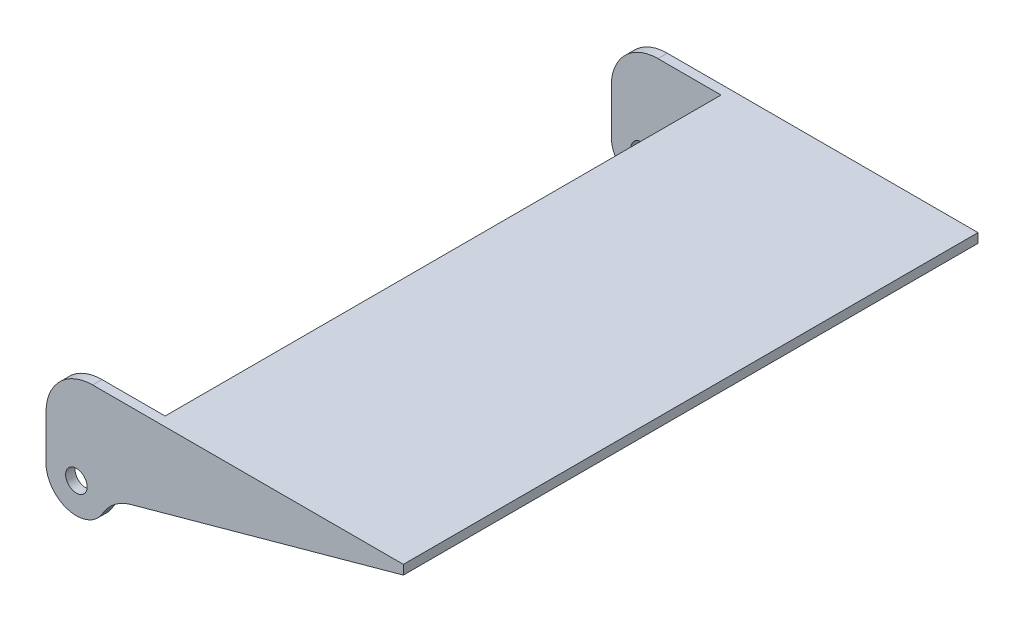
from build123d import *

# Parameters (mm, degrees)
SKETCH1_W               = 50
SKETCH1_H               = 123
BOSS_EXTRUDE1_DEPTH     = 2
BOSS_EXTRUDE2_DEPTH     = 123
CUT_EXTRUDE1_DEPTH      = 84.729178306
CUT_EXTRUDE1_DEPTH_BACK = 84.729178306
SKETCH3_W               = 119
SKETCH3_H               = 24.000498671
CUT_EXTRUDE2_DEPTH      = 85.324239069
CUT_EXTRUDE2_DEPTH_BACK = 85.324239069
SKETCH4_W               = 30.227049201
SKETCH4_H               = 119
CUT_EXTRUDE3_DEPTH      = 136.489207319
CUT_EXTRUDE3_DEPTH_BACK = 136.489207319
SKETCH5_R               = 2.3


with BuildPart() as part:
    # Sketch1 → Boss-Extrude1 (new body)
    with BuildSketch(Plane(origin=(0, 0, 0), x_dir=(1, 0, 0), z_dir=(0, 1, 0))):
        Rectangle(SKETCH1_W, SKETCH1_H)
    extrude(amount=BOSS_EXTRUDE1_DEPTH)

    # Sketch2 → Boss-Extrude2 (add)
    with BuildSketch(Plane.XY.offset(61.5)):
        with BuildLine():
            Line((-41.500498671, 2), (25, 2))
            Line((25, 2), (25, 0))
            Line((25, 0), (-33.350503344, -16.080973663))
            ThreePointArc((-33.350503344, -16.080973663), (-36.817369851, -17.815885758), (-39.363893872, -20.738949009))
            ThreePointArc((-39.363893872, -20.738949009), (-46.676153718, -23.780684014), (-51.500498671, -17.5))
            Line((-51.500498671, -17.5), (-51.500498671, -8))
            ThreePointArc((-51.500498671, -8), (-48.571566483, -0.928932188), (-41.500498671, 2))
        make_face()
    extrude(amount=-BOSS_EXTRUDE2_DEPTH)

    # Sketch3 → Cut-Extrude1 (cut, two sides: drawn at the far end of the back side and taken through both)
    with BuildSketch(Plane(origin=(0, 0, 0), x_dir=(0, 0, -1), z_dir=(1, 0, 0)).offset(-CUT_EXTRUDE1_DEPTH_BACK)):
        with Locations((0, -12.000249336)):
            Rectangle(SKETCH3_W, SKETCH3_H)
    extrude(amount=CUT_EXTRUDE1_DEPTH + CUT_EXTRUDE1_DEPTH_BACK, mode=Mode.SUBTRACT)

    # Sketch4 → Cut-Extrude2 (cut, two sides: drawn at the far end of the back side and taken through both)
    with BuildSketch(Plane(origin=(0, 2, 0), x_dir=(1, 0, 0), z_dir=(0, 1, 0)).offset(-CUT_EXTRUDE2_DEPTH_BACK)):
        with Locations((-43.1135246, 0)):
            Rectangle(SKETCH4_W, SKETCH4_H)
    extrude(amount=CUT_EXTRUDE2_DEPTH + CUT_EXTRUDE2_DEPTH_BACK, mode=Mode.SUBTRACT)

    # Sketch5 → Cut-Extrude3 (cut, two sides: drawn at the far end of the back side and taken through both)
    with BuildSketch(Plane.XY.offset(61.5).offset(-CUT_EXTRUDE3_DEPTH_BACK)):
        with Locations((-45, -17.5)):
            Circle(SKETCH5_R)
    extrude(amount=CUT_EXTRUDE3_DEPTH + CUT_EXTRUDE3_DEPTH_BACK, mode=Mode.SUBTRACT)


solid = part.part
